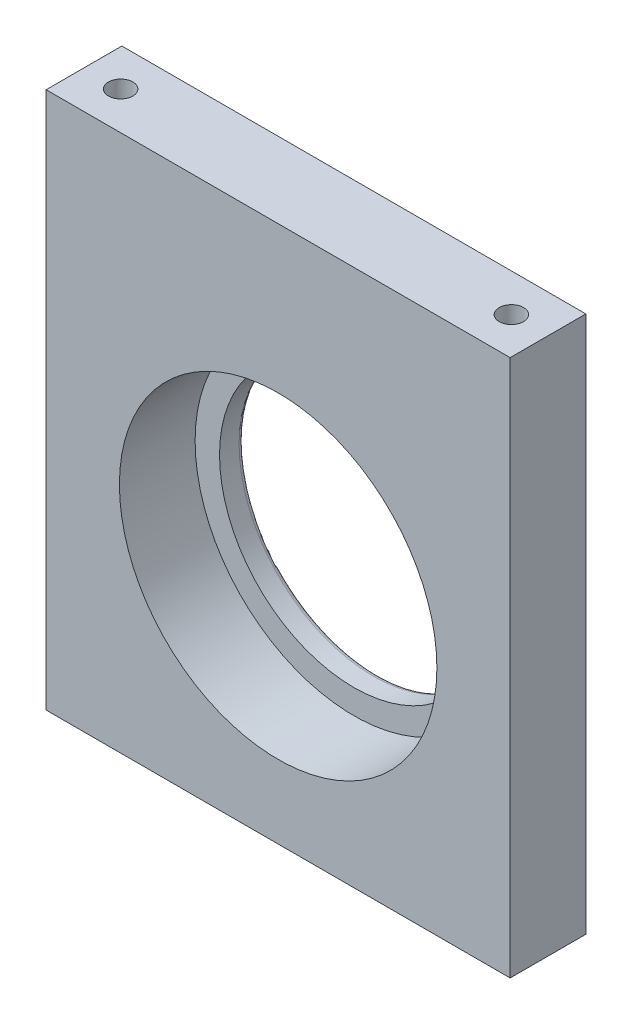
from build123d import *

# Parameters (mm, degrees)
ESQUISSE1_W             = 190
ESQUISSE1_H             = 220
ESQUISSE1_R             = 65
BOSS_EXTRU_1_DEPTH      = 31
ESQUISSE2_R             = 5
ENL_V_MAT_EXTRU_1_DEPTH = 15
ESQUISSE4_W             = 150
ESQUISSE4_H             = 150
ESQUISSE4_R             = 55
BOSS_EXTRU_2_DEPTH      = 10
CONG_1_R                = 2


with BuildPart() as part:
    # Esquisse1 → Boss.-Extru.1 (new body)
    with BuildSketch(Plane.XY):
        with Locations((0, 110)):
            Rectangle(ESQUISSE1_W, ESQUISSE1_H)
        with Locations((0, 95)):
            Circle(ESQUISSE1_R, mode=Mode.SUBTRACT)
    extrude(amount=BOSS_EXTRU_1_DEPTH)

    # Esquisse2 → Enlèv. mat.-Extru.1 (cut)
    with BuildSketch(Plane(origin=(0, 220, 0), x_dir=(1, 0, 0), z_dir=(0, 1, 0))):
        with Locations(Location((-80, -15.5, 0), (0, 0, 180))):
            Circle(ESQUISSE2_R)
    enl_v_mat_extru_1 = extrude(amount=-ENL_V_MAT_EXTRU_1_DEPTH, mode=Mode.SUBTRACT)

    # Symétrie1: Enlèv. mat.-Extru.1 across plane
    add(enl_v_mat_extru_1.mirror(Plane(origin=(0, 0, 0), x_dir=(0, 0, 1), z_dir=(1, 0, 0))), mode=Mode.SUBTRACT)

    # Esquisse4 → Boss.-Extru.2 (add)
    with BuildSketch(Plane.XY):
        with Locations((0, 95)):
            Rectangle(ESQUISSE4_W, ESQUISSE4_H)
        with Locations((0, 95)):
            Circle(ESQUISSE4_R, mode=Mode.SUBTRACT)
    extrude(amount=-BOSS_EXTRU_2_DEPTH)

    # Congé1
    cong_1_edges = [part.edges().sort_by_distance(p)[0] for p in [
        (-55, 95, -10),
        (75, 95, 0),
        (0, 170, 0),
        (-75, 95, 0),
        (0, 20, 0),
    ]]
    fillet(cong_1_edges, radius=CONG_1_R)


solid = part.part
